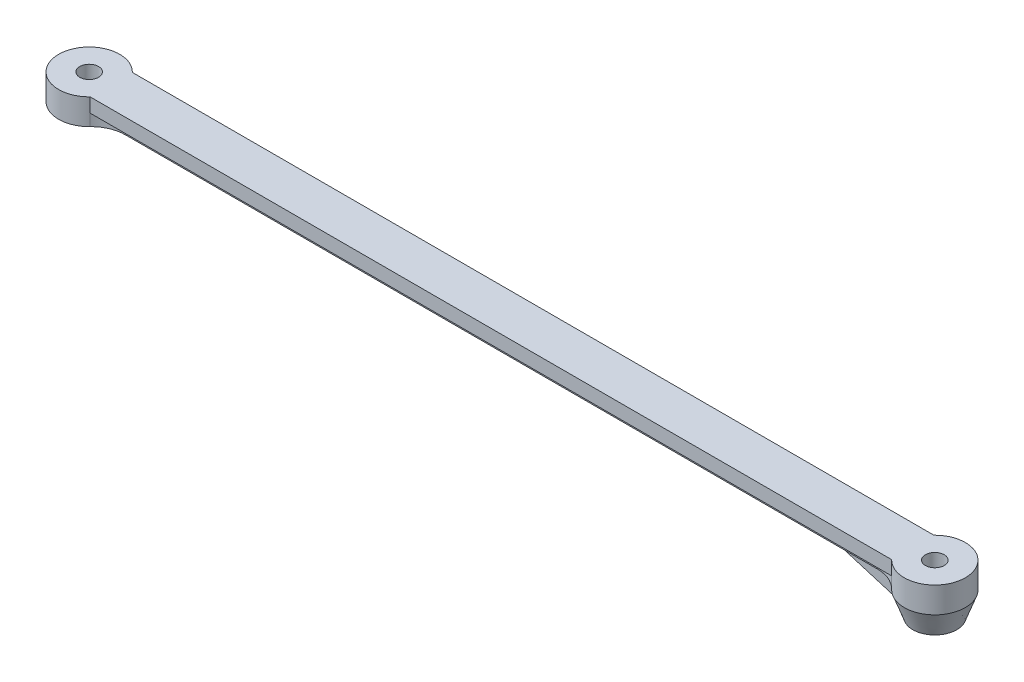
from build123d import *
from build123d.topology import SkipClean

# Parameters (mm, degrees)
SKETCH1_R           = 2
BOSS_EXTRUDE1_DEPTH = 5.5
CUT_EXTRUDE1_DEPTH  = 2.5
SKETCH4_R           = 6.5
SKETCH3_R           = 4.68
SKETCH5_R           = 2
CUT_EXTRUDE2_DEPTH  = 187.908400029
BOSS_EXTRUDE2_DEPTH = 1.25


with BuildPart() as part:
    # Sketch1 → Boss-Extrude1 (new body)
    with BuildSketch(Plane(origin=(0, 0, 0), x_dir=(1, 0, 0), z_dir=(0, 1, 0))):
        with BuildLine():
            Line((-175.30958424, 4.5), (-4.69041576, 4.5))
            ThreePointArc((-4.69041576, 4.5), (6.5, 0), (-4.69041576, -4.5))
            Line((-4.69041576, -4.5), (-175.30958424, -4.5))
            ThreePointArc((-175.30958424, -4.5), (-186.5, 0), (-175.30958424, 4.5))
        make_face()
        with Locations(Location((0, 0, 0), (0, 0, 270))):
            Circle(SKETCH1_R, mode=Mode.SUBTRACT)
        with Locations(Location((-180, 0, 0), (0, 0, 270))):
            Circle(SKETCH1_R, mode=Mode.SUBTRACT)
    extrude(amount=BOSS_EXTRUDE1_DEPTH)

    # Sketch2 → Cut-Extrude1 (cut)
    with BuildSketch(Plane.XZ):
        with BuildLine():
            Line((-9.96713349, 2.25), (-170.03286651, 2.25))
            ThreePointArc((-170.03286651, 2.25), (-172.901064987, 2.835978332), (-175.30958424, 4.5))
            Line((-175.30958424, 4.5), (-4.69041576, 4.5))
            ThreePointArc((-4.69041576, 4.5), (-7.098935013, 2.835978332), (-9.96713349, 2.25))
        make_face()
        with BuildLine():
            Line((-9.96713349, -2.25), (-170.03286651, -2.25))
            ThreePointArc((-170.03286651, -2.25), (-172.901064987, -2.835978332), (-175.30958424, -4.5))
            Line((-175.30958424, -4.5), (-4.69041576, -4.5))
            ThreePointArc((-4.69041576, -4.5), (-7.098935013, -2.835978332), (-9.96713349, -2.25))
        make_face()
    extrude(amount=-CUT_EXTRUDE1_DEPTH, mode=Mode.SUBTRACT)

    # Sketch4 → Loft1 section 0
    with BuildSketch(Plane.XZ):
        Circle(SKETCH4_R)
    # Sketch3 → Loft1 section 1
    with BuildSketch(Plane(origin=(0, -5, 0), x_dir=(-1, 0, 0), z_dir=(0, -1, 0))):
        Circle(SKETCH3_R)
    loft()

    # Sketch5 → Cut-Extrude2 (cut, through all)
    with SkipClean():  # the faces are left unmerged after this step: merging them gives an invalid solid
        with BuildSketch(Plane.XZ.offset(5)):
            with Locations(Location((0, 0, 0), (0, 0, 270))):
                Circle(SKETCH5_R)
        extrude(amount=-CUT_EXTRUDE2_DEPTH, mode=Mode.SUBTRACT)

    # Sketch6 → Boss-Extrude2 (add, symmetric)
    with SkipClean():  # the faces are left unmerged after this step: merging them gives an invalid solid
        with BuildSketch(Plane.XY):
            Polygon((-3.080000032, 0), (-21.280000032, 0), (-4.680000032, -5), (-3.080000032, -5), align=None)
        extrude(amount=BOSS_EXTRUDE2_DEPTH, both=True)


solid = part.part
